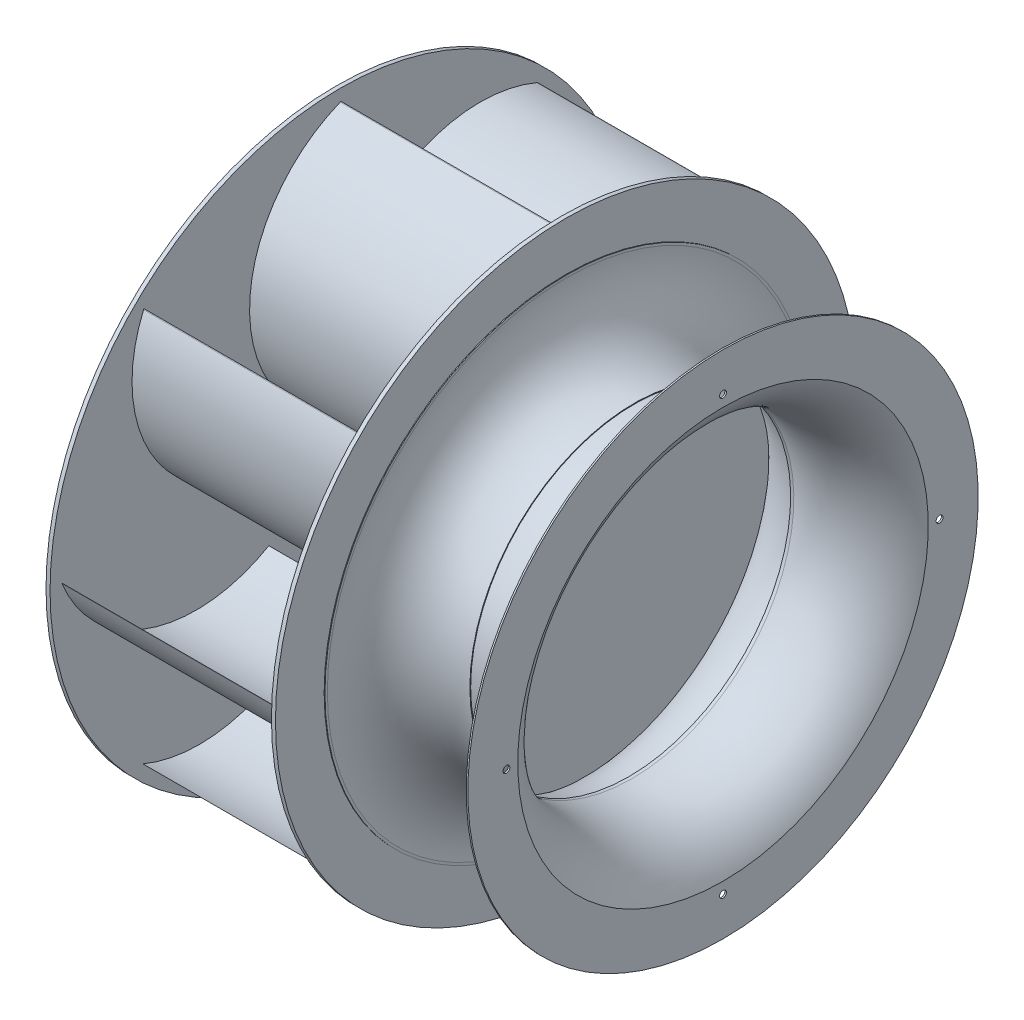
from build123d import *

# Parameters (mm, degrees)
SKETCH2_R         = 360.5
EXTRUDE1_DEPTH    = 5
SKETCH9_R         = 355.5
SKETCH9_R_2       = 100
EXTRUDE7_DEPTH    = 3
SKETCH3_R         = 360.5
EXTRUDE2_DEPTH    = 5
EXTRUDE3_DEPTH    = 280
CIRPATTERN1_COUNT = 8
SKETCH7_R         = 4.25
EXTRUDE5_DEPTH    = 5
CIRPATTERN2_COUNT = 4
SKETCH8_R         = 5
EXTRUDE6_DEPTH    = 89.5
CIRPATTERN3_COUNT = 8


with BuildPart() as part:
    # Sketch1 → Revolve1 (revolve)
    with BuildSketch(Plane.XY, mode=Mode.PRIVATE) as revolve1_sk:
        with BuildLine():
            Line((0, 0), (0, 109))
            ThreePointArc((0, 109), (1.464466094, 112.535533906), (5, 114))
            Line((5, 114), (69.5, 114))
            Line((69.5, 114), (69.5, 138))
            Line((69.5, 138), (89.5, 138))
            Line((89.5, 138), (89.5, 98))
            Line((89.5, 98), (91.5, 98))
            Line((91.5, 98), (91.5, 133))
            Line((91.5, 133), (94.5, 133))
            Line((94.5, 133), (94.5, 98))
            Line((94.5, 98), (96.5, 98))
            Line((96.5, 98), (96.5, 0))
            Line((96.5, 0), (0, 0))
        make_face()
    revolve(revolve1_sk.sketch.rotate(Axis((0, 0, 0), (1, 0, 0)), 90), axis=Axis((0, 0, 0), (1, 0, 0)))

    # Sketch2 → Extrude1 (add)
    with BuildSketch(Plane(origin=(96.5, 0, 0), x_dir=(0, 0, -1), z_dir=(1, 0, 0))):
        Circle(SKETCH2_R)
    extrude(amount=EXTRUDE1_DEPTH)

    # Sketch9 → Extrude7 (cut)
    with BuildSketch(Plane.ZY.offset(-96.5)):
        Circle(SKETCH9_R)
        Circle(SKETCH9_R_2, mode=Mode.SUBTRACT)
    extrude(amount=-EXTRUDE7_DEPTH, mode=Mode.SUBTRACT)



with BuildPart() as body_2:
    # Sketch3 → Extrude2 (new body)
    with BuildSketch(Plane(origin=(376.5, 0, 0), x_dir=(0, 0, -1), z_dir=(1, 0, 0))):
        Circle(SKETCH3_R)
    extrude(amount=EXTRUDE2_DEPTH)


with BuildPart() as part_1:
    add(part.part)

    add(body_2.part)  # Extrude3 merges body 2
    # Sketch4 → Extrude3 (add)
    with BuildSketch(Plane(origin=(101.5, 0, 0), x_dir=(0, 0, -1), z_dir=(1, 0, 0))):
        with BuildLine():
            Line((0, 125), (0.866025404, 124.5))
            ThreePointArc((0.866025404, 124.5), (95.805210607, 239.87865649), (245.171418304, 243.8053929))
            Line((245.171418304, 243.8053929), (244.3053929, 244.3053929))
            ThreePointArc((244.3053929, 244.3053929), (94.939185203, 240.37865649), (0, 125))
        make_face()
    extrude3 = extrude(amount=EXTRUDE3_DEPTH)

    # CirPattern1: Extrude3 ×8 about axis
    cirpattern1_axis = Axis((0, 0, 0), (1, 0, 0))
    for i in range(1, CIRPATTERN1_COUNT):
        add(extrude3.rotate(cirpattern1_axis, i * 360 / CIRPATTERN1_COUNT))

    # Sketch5 → Revolve2 (revolve)
    with BuildSketch(Plane.XY, mode=Mode.PRIVATE) as revolve2_sk:
        with BuildLine():
            Line((381.5, 300), (382.5, 300))
            Line((382.5, 300), (382.5, 297))
            ThreePointArc((382.5, 297), (404.043751848, 232.023388766), (466.5, 204))
            Line((466.5, 204), (466.5, 203))
            ThreePointArc((466.5, 203), (402.975614999, 230.988588031), (381.5, 297))
            Line((381.5, 297), (381.5, 300))
        make_face()
    revolve(revolve2_sk.sketch.rotate(Axis((0, 0, 0), (1, 0, 0)), 90), axis=Axis((0, 0, 0), (1, 0, 0)))

    # Sketch8 → Extrude6 (cut)
    with BuildSketch(Plane(origin=(0, 0, 0), x_dir=(0, 0, -1), z_dir=(1, 0, 0))):
        with Locations(Location((0, 126, 0), (0, 0, 180))):
            Circle(SKETCH8_R)
    extrude6 = extrude(amount=EXTRUDE6_DEPTH, mode=Mode.SUBTRACT)

    # CirPattern3: Extrude6 ×8 about axis
    cirpattern3_axis = Axis((0, 0, 0), (1, 0, 0))
    for i in range(1, CIRPATTERN3_COUNT):
        add(extrude6.rotate(cirpattern3_axis, i * 360 / CIRPATTERN3_COUNT), mode=Mode.SUBTRACT)


with BuildPart() as body_2_2:
    # Sketch6 → Revolve3 (revolve)
    with BuildSketch(Plane.XY, mode=Mode.PRIVATE) as revolve3_sk:
        with BuildLine():
            Line((577, 317), (575, 317))
            Line((575, 317), (575, 255))
            ThreePointArc((575, 255), (528.401338972, 209.999064886), (464, 203))
            Line((464, 203), (460, 203))
            Line((460, 203), (460, 201))
            Line((460, 201), (464, 201))
            ThreePointArc((464, 201), (530.000318465, 208.119703952), (577, 255))
            Line((577, 255), (577, 317))
        make_face()
    revolve(revolve3_sk.sketch.rotate(Axis((0, 0, 0), (1, 0, 0)), 180), axis=Axis((0, 0, 0), (1, 0, 0)))

    # Sketch7 → Extrude5 (cut)
    with BuildSketch(Plane(origin=(577, 0, 0), x_dir=(0, 0, -1), z_dir=(1, 0, 0))):
        with Locations((0, 269)):
            Circle(SKETCH7_R)
    extrude5 = extrude(amount=-EXTRUDE5_DEPTH, mode=Mode.SUBTRACT)

    # CirPattern2: Extrude5 ×4 about axis
    cirpattern2_axis = Axis((0, 0, 0), (1, 0, 0))
    for i in range(1, CIRPATTERN2_COUNT):
        add(extrude5.rotate(cirpattern2_axis, i * 360 / CIRPATTERN2_COUNT), mode=Mode.SUBTRACT)


solid = Compound([part_1.part, body_2_2.part])
